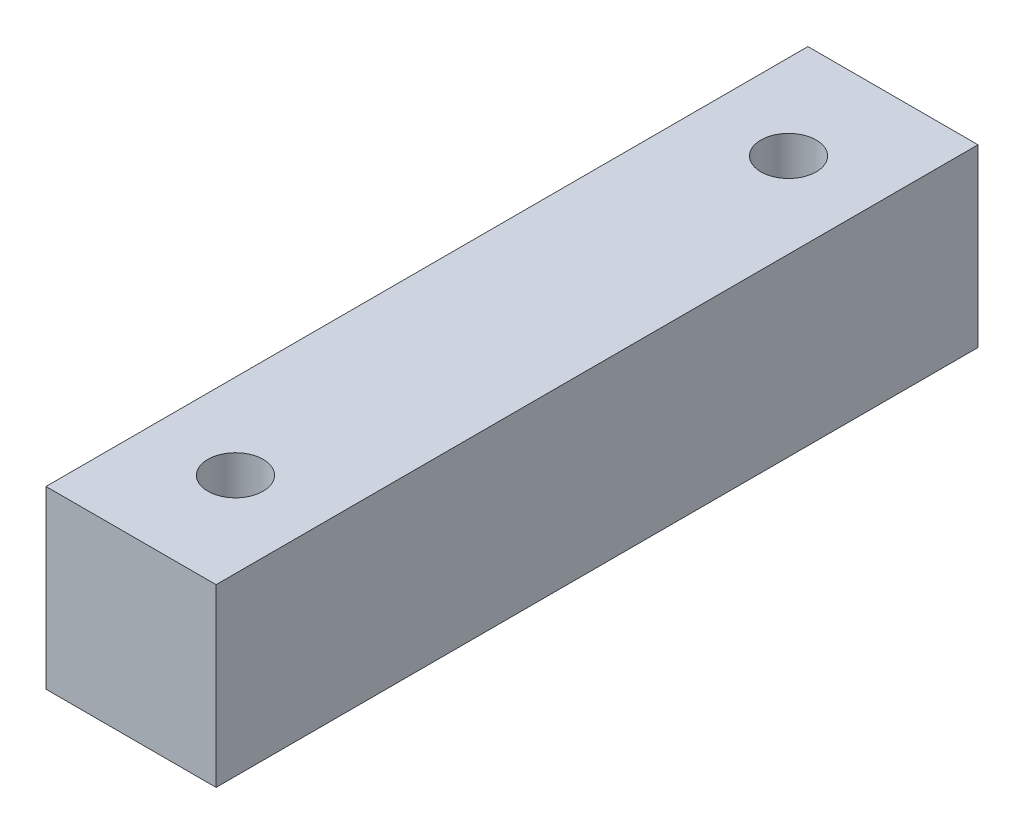
from build123d import *

# Parameters (mm, degrees)
SKETCH1_W           = 12.3
SKETCH1_H           = 55.1
BOSS_EXTRUDE1_DEPTH = 12.7
SKETCH2_R           = 2
CUT_EXTRUDE1_DEPTH  = 14


with BuildPart() as part:
    # Sketch1 → Boss-Extrude1 (new body)
    with BuildSketch(Plane(origin=(0, 0, 0), x_dir=(1, 0, 0), z_dir=(0, 1, 0))):
        with Locations((-35.203448276, 14.666810345)):
            Rectangle(SKETCH1_W, SKETCH1_H)
    extrude(amount=BOSS_EXTRUDE1_DEPTH)

    # Sketch2 → Cut-Extrude1 (cut)
    with BuildSketch(Plane(origin=(0, 12.7, 0), x_dir=(1, 0, 0), z_dir=(0, 1, 0))):
        with Locations(Location((-35.203448276, -5.333189655, 0), (0, 0, 270))):
            Circle(SKETCH2_R)
        with Locations(Location((-35.203448276, 34.666810345, 0), (0, 0, 270))):
            Circle(SKETCH2_R)
    extrude(amount=-CUT_EXTRUDE1_DEPTH, mode=Mode.SUBTRACT)


solid = part.part
